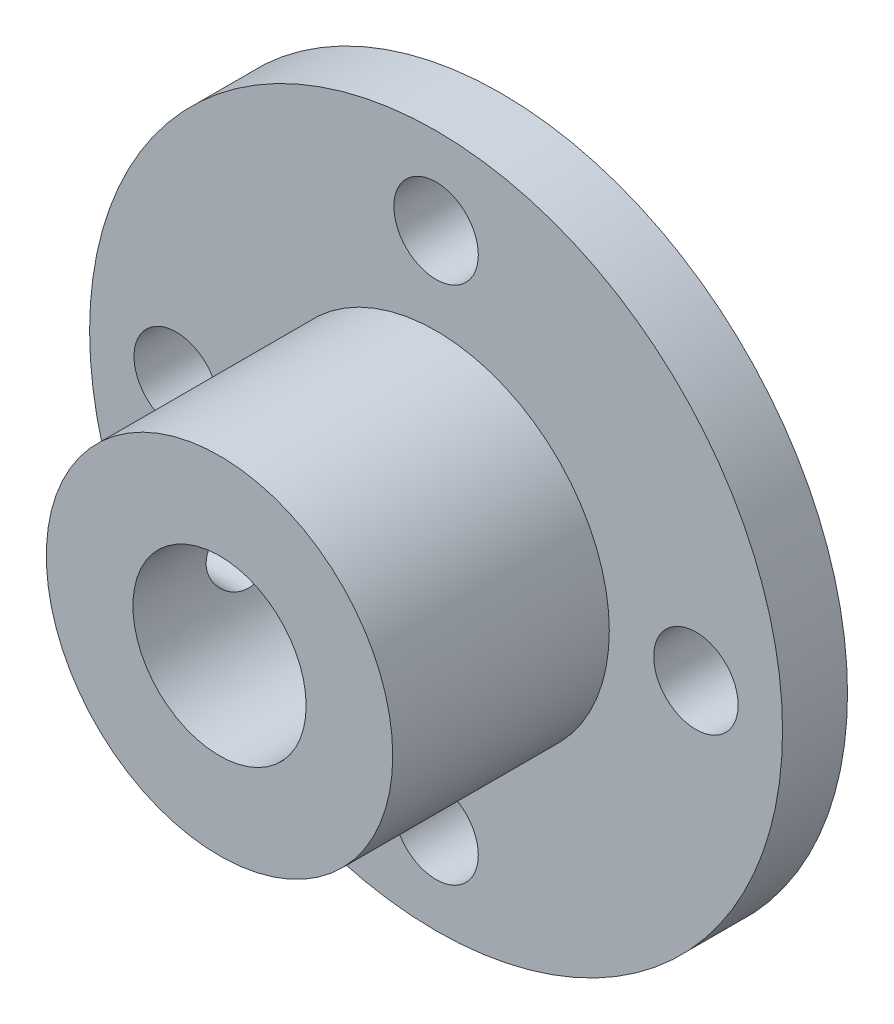
from build123d import *

# Parameters (mm, degrees)
SCHIZZO1_W                   = 16
SCHIZZO1_H                   = 3
SCHIZZO2_R                   = 8
ESTRUSIONE_ESTRUSIONE1_DEPTH = 10
FORO_3_9_3_9_1_D             = 3.9
FORO_8_0_8_1_D               = 8
FORO_PER_VITE_M3_1_REACH     = 31.933
FORO_PER_VITE_M3_1_BORE_R    = 1.62


with BuildPart() as part:
    # Schizzo1 → Rivoluzione1 (revolve)
    with BuildSketch(Plane(origin=(0, 0, 0), x_dir=(1, 0, 0), z_dir=(0, 1, 0))):
        with Locations((8, -1.5)):
            Rectangle(SCHIZZO1_W, SCHIZZO1_H)
    revolve(axis=Axis((0, 0, 0), (0, 0, 1)))

    # Schizzo2 → Estrusione-Estrusione1 (add)
    with BuildSketch(Plane.XY.offset(3)):
        Circle(SCHIZZO2_R)
    extrude(amount=ESTRUSIONE_ESTRUSIONE1_DEPTH)

    # Foro Ø3.9 (3.9)-1 (through all)
    with Locations(Plane.XY.offset(3)):
        with Locations((12, 0), (0, 12), (-12, 0), (0, -12)):
            Hole(FORO_3_9_3_9_1_D / 2)

    # Foro Ø8.0 (8)-1 (through all)
    with Locations(Plane.XY.offset(13)):
        with Locations((0, 0)):
            Hole(FORO_8_0_8_1_D / 2)

    # Foro per Vite M3-1 bore (on position points) → Foro per Vite M3-1 (cut, up to next)
    with BuildSketch(Plane(origin=(-8, 0, 8), x_dir=(0, 0, -1), z_dir=(-1, 0, 0)), mode=Mode.PRIVATE) as foro_per_vite_m3_1_sk1:
        Circle(FORO_PER_VITE_M3_1_BORE_R)
    foro_per_vite_m3_1_tool1 = extrude(foro_per_vite_m3_1_sk1.sketch, amount=-FORO_PER_VITE_M3_1_REACH, mode=Mode.PRIVATE) & part.part
    add(foro_per_vite_m3_1_tool1.solids().sort_by_distance((-8, 0, 8))[0], mode=Mode.SUBTRACT)


solid = part.part
